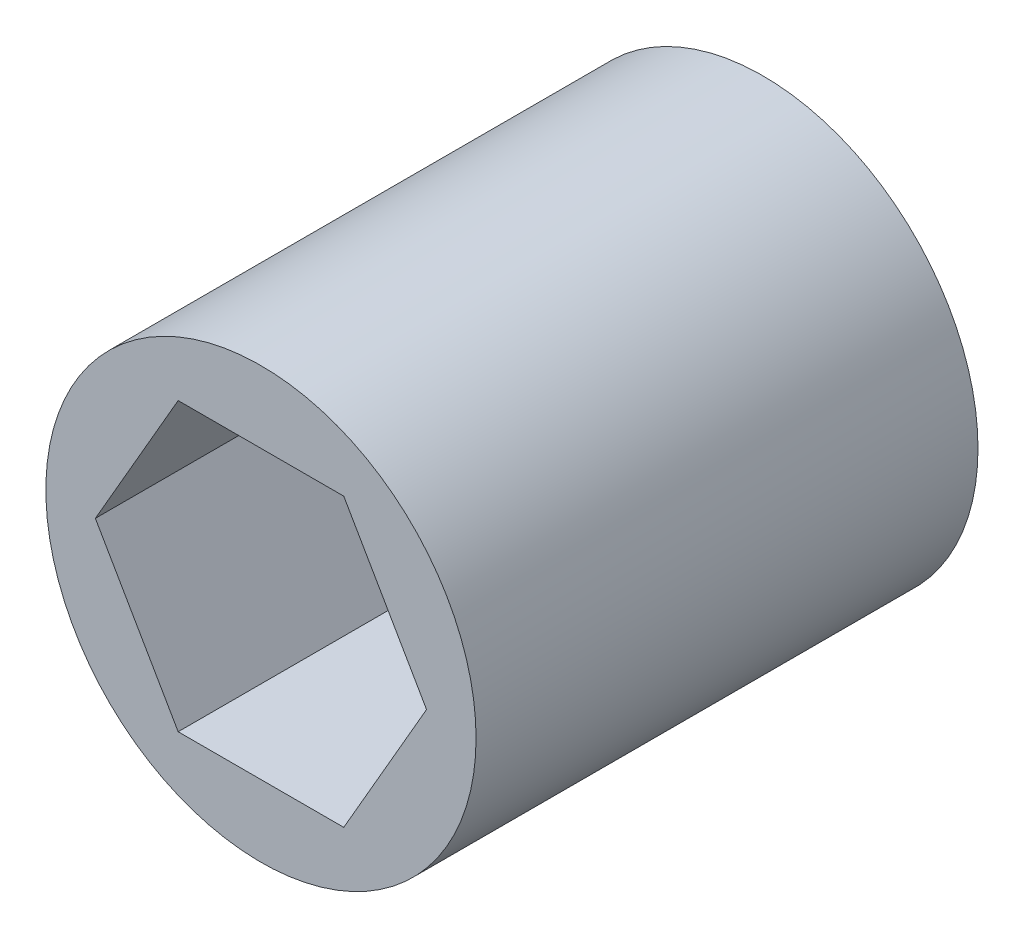
from build123d import *

# Parameters (mm, degrees)
SKETCH1_R           = 9.525
BOSS_EXTRUDE1_DEPTH = 22.225


with BuildPart() as part:
    # Sketch1 → Boss-Extrude1 (new body)
    with BuildSketch(Plane.XY):
        Circle(SKETCH1_R)
        Polygon((-3.666174209, 6.35), (-7.332348419, 0), (-3.666174209, -6.35), (3.666174209, -6.35), (7.332348419, 0), (3.666174209, 6.35), align=None, mode=Mode.SUBTRACT)
    extrude(amount=BOSS_EXTRUDE1_DEPTH)


solid = part.part
